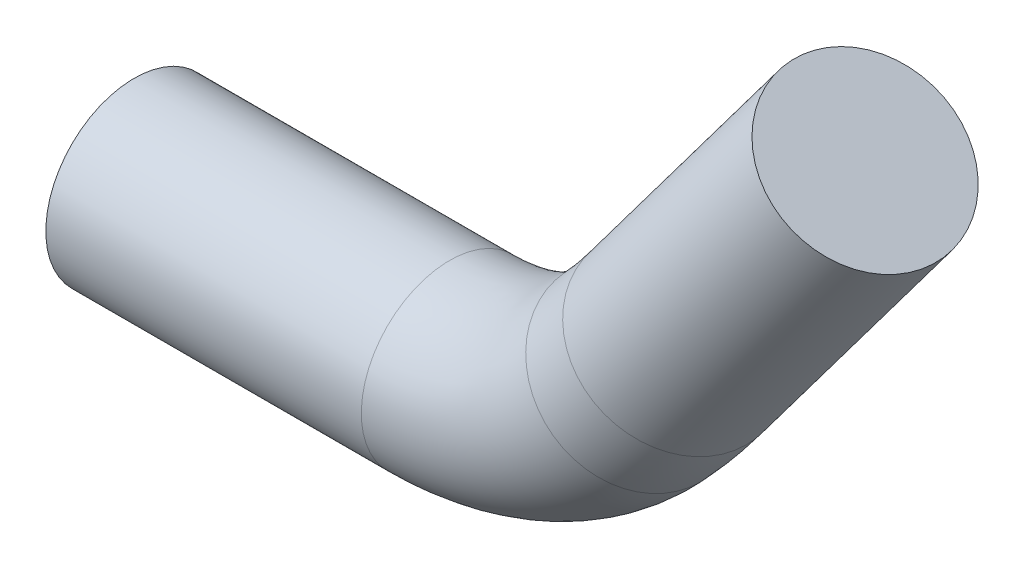
from build123d import *

# Parameters (mm, degrees)
SKETCH1_R = 3.556


with BuildPart() as part:
    # Sweep1: sweep along a path in Sketch3
    with BuildLine(Plane.XY) as sweep1_path:
        Line((0, 0), (12.7, 0))
        ThreePointArc((12.7, 0), (16.78315101, 0.856587839), (20.177802511, 3.281913813))
        ThreePointArc((20.177802511, 3.281913813), (21.01503046, 4.239168877), (21.803296233, 5.237129281))
        Line((21.803296233, 5.237129281), (29.423296233, 15.397129281))
    # Sketch1 → Sweep1 (sweep)
    with BuildSketch(Plane(origin=(0, 0, 0), x_dir=(0, 0, -1), z_dir=(1, 0, 0))):
        Circle(SKETCH1_R)
    sweep(path=sweep1_path.line)


solid = part.part
